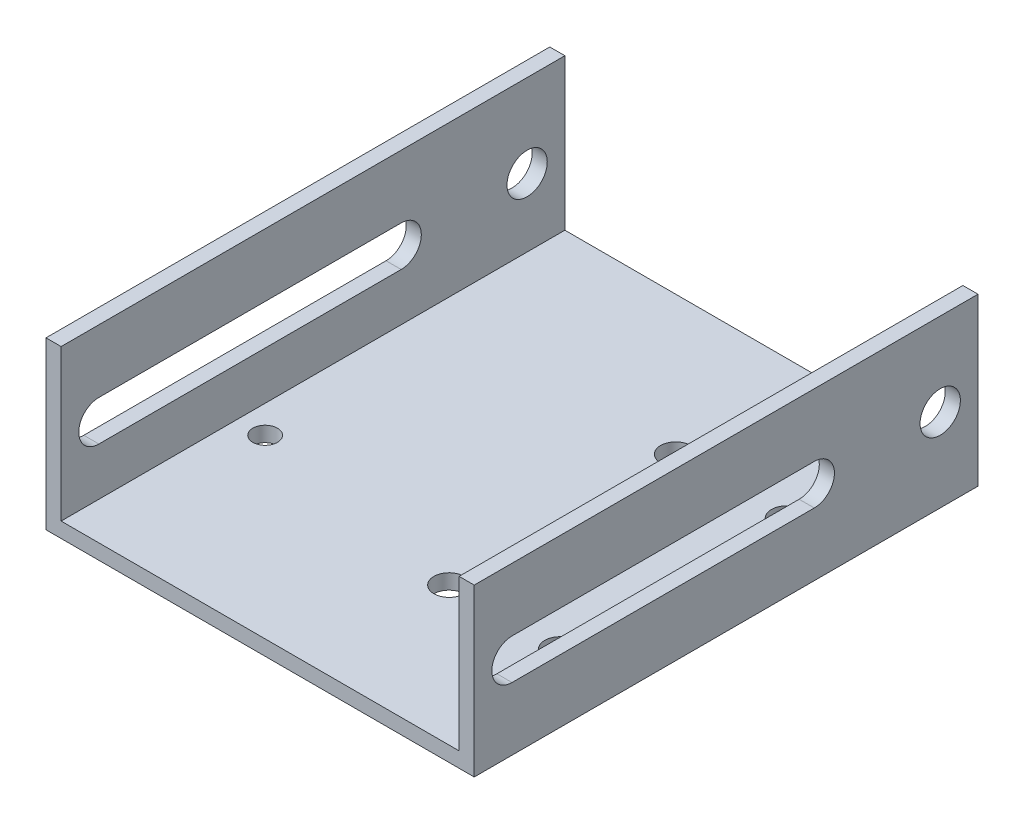
from build123d import *

# Parameters (mm, degrees)
SKETCH_1_W          = 85
SKETCH_1_H          = 100
EXTRUDE_1_DEPTH     = 3
SKETCH_2_W          = 3
SKETCH_2_H          = 100
EXTRUDE_2_DEPTH     = 30
CUT_EXTRUDE_1_REACH = 105.99
SKETCH_3_R          = 4
SKETCH_4_R          = 3
SKETCH_4_R_2        = 2
SKETCH_4_R_3        = 2.445405454
CUT_EXTRUDE_3_DEPTH = 74.452365517


with BuildPart() as part:
    # 草图1 → 凸台-拉伸1 (new body)
    with BuildSketch(Plane(origin=(0, 0, 0), x_dir=(1, 0, 0), z_dir=(0, 1, 0))):
        Rectangle(SKETCH_1_W, SKETCH_1_H)
    extrude(amount=EXTRUDE_1_DEPTH)

    # 草图2 → 凸台-拉伸2 (add)
    with BuildSketch(Plane(origin=(0, 3, 0), x_dir=(1, 0, 0), z_dir=(0, 1, 0))):
        with Locations((-41, 0)):
            Rectangle(SKETCH_2_W, SKETCH_2_H)
        with Locations((41, 0)):
            Rectangle(SKETCH_2_W, SKETCH_2_H)
    extrude(amount=EXTRUDE_2_DEPTH)

    # 切除-拉伸1: up to this face of the body (flat: up to its plane)
    cut_extrude_1_end = Plane(part.part.faces().sort_by_distance((-42.5, 16.5, 0))[0])
    # 草图3 → 切除-拉伸1 (cut, up to the picked face)
    with BuildSketch(Plane(origin=(42.5, 0, 0), x_dir=(0, 0, -1), z_dir=(1, 0, 0)), mode=Mode.PRIVATE) as cut_extrude_1_sk1:
        with Locations((42.5, 16.5)):
            Circle(SKETCH_3_R)
    cut_extrude_1_tool1 = split(extrude(cut_extrude_1_sk1.sketch, amount=-CUT_EXTRUDE_1_REACH, mode=Mode.PRIVATE), bisect_by=cut_extrude_1_end, keep=Keep.BOTH, mode=Mode.PRIVATE)
    # 草图3 → 切除-拉伸1 (cut, up to the picked face)
    with BuildSketch(Plane(origin=(42.5, 0, 0), x_dir=(0, 0, -1), z_dir=(1, 0, 0)), mode=Mode.PRIVATE) as cut_extrude_1_sk2:
        with BuildLine():
            Line((-42.5, 12.5), (17.5, 12.5))
            ThreePointArc((17.5, 12.5), (21.5, 16.5), (17.5, 20.5))
            Line((17.5, 20.5), (-42.5, 20.5))
            ThreePointArc((-42.5, 20.5), (-46.5, 16.5), (-42.5, 12.5))
        make_face()
    cut_extrude_1_tool2 = split(extrude(cut_extrude_1_sk2.sketch, amount=-CUT_EXTRUDE_1_REACH, mode=Mode.PRIVATE), bisect_by=cut_extrude_1_end, keep=Keep.BOTH, mode=Mode.PRIVATE)
    add(cut_extrude_1_tool1.solids().sort_by(Axis((42.5, 16.5, -42.5), (-1, 0, 0)))[0], mode=Mode.SUBTRACT)
    add(cut_extrude_1_tool2.solids().sort_by(Axis((42.5, 16.5, 12.5), (-1, 0, 0)))[0], mode=Mode.SUBTRACT)

    # 草图4 → 切除-拉伸3 (cut, through all)
    with BuildSketch(Plane.XZ):
        with Locations(Location((21, 0, 0), (0, 0, 270))):
            Circle(SKETCH_4_R)
        with Locations(Location((10, -22.5, 0), (0, 0, 270))):
            Circle(SKETCH_4_R)
        with Locations(Location((32, -22.5, 0), (0, 0, 270))):
            Circle(SKETCH_4_R)
        with Locations(Location((10, 22.5, 0), (0, 0, 270))):
            Circle(SKETCH_4_R)
        with Locations(Location((32, 22.5, 0), (0, 0, 270))):
            Circle(SKETCH_4_R)
        with Locations(Location((21, -45, 0), (0, 0, 270))):
            Circle(SKETCH_4_R_2)
        with Locations(Location((-34, 15, 0), (0, 0, 270))):
            Circle(SKETCH_4_R_3)
    extrude(amount=-CUT_EXTRUDE_3_DEPTH, mode=Mode.SUBTRACT)


solid = part.part
